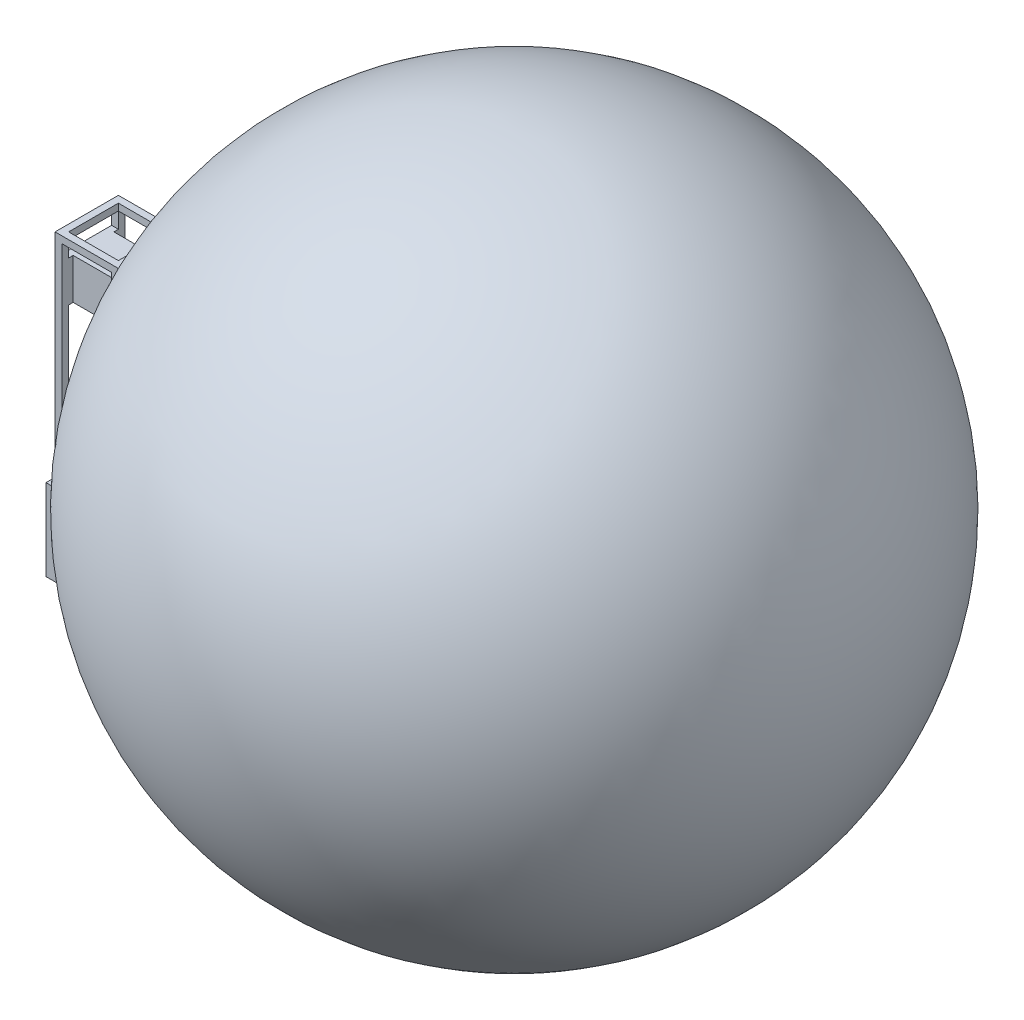
from build123d import *

# Parameters (mm, degrees)
SKETCH1_W                       = 640
SKETCH1_H                       = 160
BOSS_EXTRUDE1_DEPTH             = 180
SKETCH2_W                       = 160
SKETCH2_H                       = 160
CUT_EXTRUDE1_DEPTH              = 480
SKETCH5_W                       = 15
SKETCH5_H                       = 15
BOSS_EXTRUDE2_DEPTH             = 480
SKETCH6_W                       = 15
SKETCH6_H                       = 15
BOSS_EXTRUDE3_DEPTH             = 110
SKETCH7_W                       = 15
SKETCH7_H                       = 15
BOSS_EXTRUDE4_DEPTH             = 110
SKETCH9_W                       = 90
SKETCH9_H                       = 90
BOSS_EXTRUDE5_DEPTH             = 140
BOSS_EXTRUDE6_REACH             = 929.807
SKETCH10_W                      = 15
SKETCH10_H                      = 90
BOSS_EXTRUDE6_DIRECTION_2_REACH = 929.807
SKETCH8_R                       = 70
BOSS_EXTRUDE7_DEPTH             = 80


with BuildPart() as part:
    # Sketch1 → Boss-Extrude1 (new body)
    with BuildSketch(Plane(origin=(0, 0, 0), x_dir=(1, 0, 0), z_dir=(0, 1, 0))):
        with Locations((320, 80)):
            Rectangle(SKETCH1_W, SKETCH1_H)
    extrude(amount=BOSS_EXTRUDE1_DEPTH)

    # Sketch2 → Cut-Extrude1 (cut)
    with BuildSketch(Plane(origin=(640, 0, 0), x_dir=(0, 0, -1), z_dir=(1, 0, 0))):
        with Locations((80, 100)):
            Rectangle(SKETCH2_W, SKETCH2_H)
    extrude(amount=-CUT_EXTRUDE1_DEPTH, mode=Mode.SUBTRACT)

    # Sketch5 → Boss-Extrude2 (add)
    with BuildSketch(Plane(origin=(0, 180, 0), x_dir=(1, 0, 0), z_dir=(0, 1, 0))):
        with Locations((17.5, 142.5)):
            Rectangle(SKETCH5_W, SKETCH5_H)
        with Locations((142.5, 142.5)):
            Rectangle(SKETCH5_W, SKETCH5_H)
        with Locations((142.5, 17.5)):
            Rectangle(SKETCH5_W, SKETCH5_H)
        with Locations((17.5, 17.5)):
            Rectangle(SKETCH5_W, SKETCH5_H)
    extrude(amount=BOSS_EXTRUDE2_DEPTH)

    # Sketch6 → Boss-Extrude3 (add)
    with BuildSketch(Plane(origin=(25, 0, 0), x_dir=(0, 0, -1), z_dir=(1, 0, 0))):
        with Locations((17.5, 652.5)):
            Rectangle(SKETCH6_W, SKETCH6_H)
        with Locations((142.5, 652.5)):
            Rectangle(SKETCH6_W, SKETCH6_H)
    extrude(amount=BOSS_EXTRUDE3_DEPTH)

    # Sketch7 → Boss-Extrude4 (add)
    with BuildSketch(Plane(origin=(0, 0, -25), x_dir=(-1, 0, 0), z_dir=(0, 0, -1))):
        with Locations((-142.5, 652.5)):
            Rectangle(SKETCH7_W, SKETCH7_H)
        with Locations((-17.5, 652.5)):
            Rectangle(SKETCH7_W, SKETCH7_H)
    extrude(amount=BOSS_EXTRUDE4_DEPTH)

    # Boss-Extrude6: up to this face of the body (flat: up to its plane)
    boss_extrude6_end = Plane(part.part.faces().sort_by_distance((17.5, 412.5, -25))[0])
    # Sketch10 → Boss-Extrude6 (add, up to the picked face)
    with BuildSketch(Plane.XY.offset(-35), mode=Mode.PRIVATE) as boss_extrude6_sk1:
        with Locations((17.5, 565)):
            Rectangle(SKETCH10_W, SKETCH10_H)
    boss_extrude6_tool1 = split(extrude(boss_extrude6_sk1.sketch, amount=BOSS_EXTRUDE6_REACH, mode=Mode.PRIVATE), bisect_by=boss_extrude6_end, keep=Keep.BOTH, mode=Mode.PRIVATE)
    # Sketch10 → Boss-Extrude6 (add, up to the picked face)
    with BuildSketch(Plane.XY.offset(-35), mode=Mode.PRIVATE) as boss_extrude6_sk2:
        with Locations((142.5, 565)):
            Rectangle(SKETCH10_W, SKETCH10_H)
    boss_extrude6_tool2 = split(extrude(boss_extrude6_sk2.sketch, amount=BOSS_EXTRUDE6_REACH, mode=Mode.PRIVATE), bisect_by=boss_extrude6_end, keep=Keep.BOTH, mode=Mode.PRIVATE)


with BuildPart() as body_2:
    # Sketch9 → Boss-Extrude5 (new body)
    with BuildSketch(Plane(origin=(150, 0, 0), x_dir=(0, 0, -1), z_dir=(1, 0, 0))):
        with Locations((80, 565)):
            Rectangle(SKETCH9_W, SKETCH9_H)
    extrude(amount=-BOSS_EXTRUDE5_DEPTH)


with BuildPart() as part_1:
    add(part.part)

    add(body_2.part)  # Boss-Extrude6 merges body 2
    add(boss_extrude6_tool1.solids().sort_by(Axis((17.5, 565, -35), (0, 0, 1)))[0])
    add(boss_extrude6_tool2.solids().sort_by(Axis((142.5, 565, -35), (0, 0, 1)))[0])

    # Boss-Extrude6 direction 2: up to this face of the body (flat: up to its plane)
    boss_extrude6_direction_2_end = Plane(part_1.part.faces().sort_by_distance((17.5, 412.5, -135))[0])
    # Sketch10 → Boss-Extrude6 direction 2 (add, up to the picked face)
    with BuildSketch(Plane.XY.offset(-35), mode=Mode.PRIVATE) as boss_extrude6_direction_2_sk1:
        with Locations((17.5, 565)):
            Rectangle(SKETCH10_W, SKETCH10_H)
    boss_extrude6_direction_2_tool1 = split(extrude(boss_extrude6_direction_2_sk1.sketch, amount=-BOSS_EXTRUDE6_DIRECTION_2_REACH, mode=Mode.PRIVATE), bisect_by=boss_extrude6_direction_2_end, keep=Keep.BOTH, mode=Mode.PRIVATE)
    # Sketch10 → Boss-Extrude6 direction 2 (add, up to the picked face)
    with BuildSketch(Plane.XY.offset(-35), mode=Mode.PRIVATE) as boss_extrude6_direction_2_sk2:
        with Locations((142.5, 565)):
            Rectangle(SKETCH10_W, SKETCH10_H)
    boss_extrude6_direction_2_tool2 = split(extrude(boss_extrude6_direction_2_sk2.sketch, amount=-BOSS_EXTRUDE6_DIRECTION_2_REACH, mode=Mode.PRIVATE), bisect_by=boss_extrude6_direction_2_end, keep=Keep.BOTH, mode=Mode.PRIVATE)
    add(boss_extrude6_direction_2_tool1.solids().sort_by(Axis((17.5, 565, -35), (0, 0, -1)))[0])
    add(boss_extrude6_direction_2_tool2.solids().sort_by(Axis((142.5, 565, -35), (0, 0, -1)))[0])

    # Sketch8 → Boss-Extrude7 (add)
    with BuildSketch(Plane(origin=(150, 0, 0), x_dir=(0, 0, -1), z_dir=(1, 0, 0))):
        with Locations((80, 565)):
            Circle(SKETCH8_R)
    extrude(amount=BOSS_EXTRUDE7_DEPTH)


with BuildPart() as body_2_2:
    # Sketch11 → Revolve1 (revolve)
    with BuildSketch(Plane.XY.offset(-80)):
        with BuildLine():
            Line((955, 1290), (955, -160))
            ThreePointArc((955, -160), (230, 565), (955, 1290))
        make_face()
    revolve(axis=Axis((955, 1290, -80), (0, -1, 0)))


solid = Compound([part_1.part, body_2_2.part])
